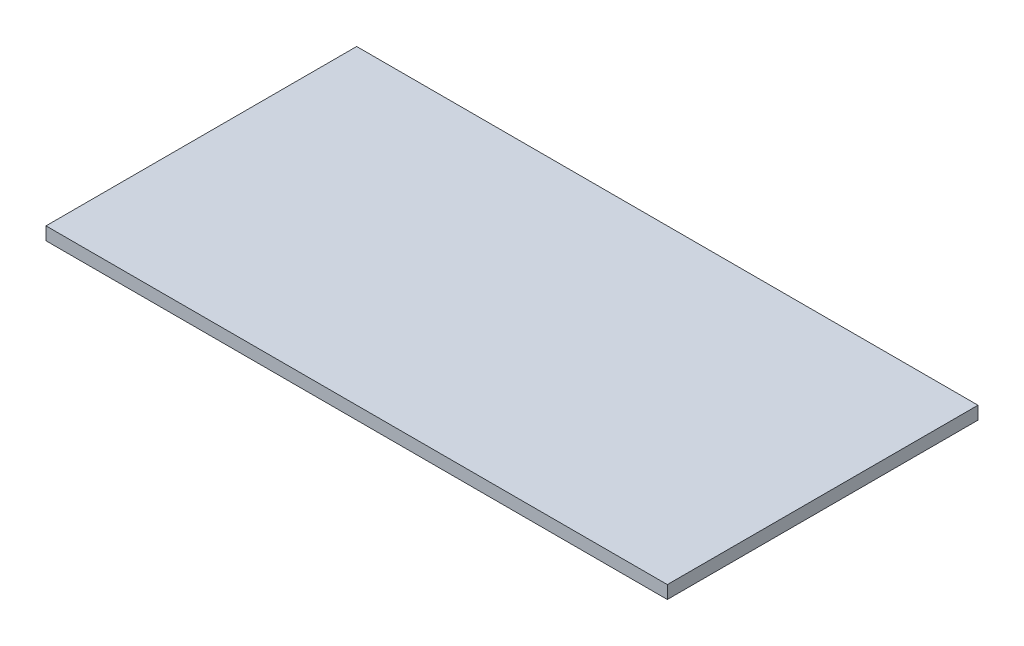
from build123d import *

# Parameters (mm, degrees)
SKETCH1_W           = 152.4
SKETCH1_H           = 76.2
BOSS_EXTRUDE1_DEPTH = 3.175


with BuildPart() as part:
    # Sketch1 → Boss-Extrude1 (new body)
    with BuildSketch(Plane(origin=(0, 0, 0), x_dir=(1, 0, 0), z_dir=(0, 1, 0))):
        with Locations((76.2, 38.1)):
            Rectangle(SKETCH1_W, SKETCH1_H)
    extrude(amount=BOSS_EXTRUDE1_DEPTH)


solid = part.part
